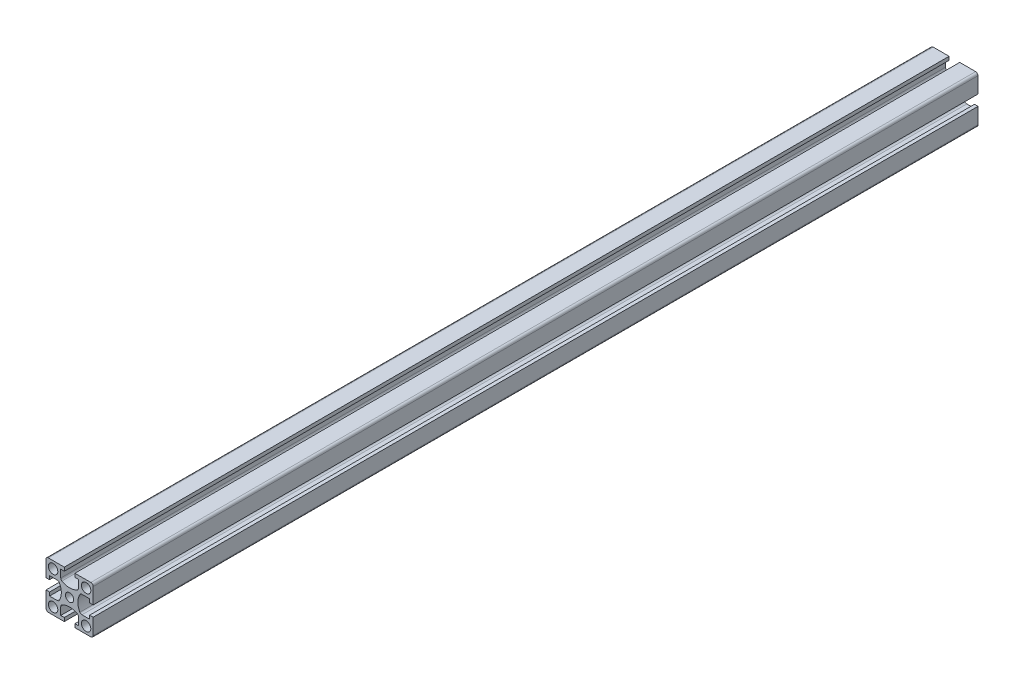
from build123d import *

# Parameters (mm, degrees)
SKETCH1_R           = 2
SKETCH1_R_2         = 1.75
BOSS_EXTRUDE1_DEPTH = 375


with BuildPart() as part:
    # Sketch1 → Boss-Extrude1 (new body)
    with BuildSketch(Plane.XY):
        with BuildLine():
            Line((-10, 9), (-10, 2.25))
            Line((-10, 2.25), (-8.5, 2.25))
            Line((-8.5, 2.25), (-8.5, 3.75))
            Line((-8.5, 3.75), (-5.236860279, 3.75))
            ThreePointArc((-5.236860279, 3.75), (-4.736860279, 3.616025404), (-4.370834875, 3.25))
            ThreePointArc((-4.370834875, 3.25), (-3.5, 0), (-4.370834875, -3.25))
            ThreePointArc((-4.370834875, -3.25), (-4.736860279, -3.616025404), (-5.236860279, -3.75))
            Line((-5.236860279, -3.75), (-8.5, -3.75))
            Line((-8.5, -3.75), (-8.5, -2.25))
            Line((-8.5, -2.25), (-10, -2.25))
            Line((-10, -2.25), (-10, -9))
            ThreePointArc((-10, -9), (-9.707106781, -9.707106781), (-9, -10))
            Line((-9, -10), (-2.25, -10))
            Line((-2.25, -10), (-2.25, -8.5))
            Line((-2.25, -8.5), (-3.75, -8.5))
            Line((-3.75, -8.5), (-3.75, -5.236860279))
            ThreePointArc((-3.75, -5.236860279), (-3.616025404, -4.736860279), (-3.25, -4.370834875))
            ThreePointArc((-3.25, -4.370834875), (0, -3.5), (3.25, -4.370834875))
            ThreePointArc((3.25, -4.370834875), (3.616025404, -4.736860279), (3.75, -5.236860279))
            Line((3.75, -5.236860279), (3.75, -8.5))
            Line((3.75, -8.5), (2.25, -8.5))
            Line((2.25, -8.5), (2.25, -10))
            Line((2.25, -10), (9, -10))
            ThreePointArc((9, -10), (9.707106781, -9.707106781), (10, -9))
            Line((10, -9), (10, -2.25))
            Line((10, -2.25), (8.5, -2.25))
            Line((8.5, -2.25), (8.5, -3.75))
            Line((8.5, -3.75), (5.236860279, -3.75))
            ThreePointArc((5.236860279, -3.75), (4.736860279, -3.616025404), (4.370834875, -3.25))
            ThreePointArc((4.370834875, -3.25), (3.5, 0), (4.370834875, 3.25))
            ThreePointArc((4.370834875, 3.25), (4.736860279, 3.616025404), (5.236860279, 3.75))
            Line((5.236860279, 3.75), (8.5, 3.75))
            Line((8.5, 3.75), (8.5, 2.25))
            Line((8.5, 2.25), (10, 2.25))
            Line((10, 2.25), (10, 9))
            ThreePointArc((10, 9), (9.707106781, 9.707106781), (9, 10))
            Line((9, 10), (2.25, 10))
            Line((2.25, 10), (2.25, 8.5))
            Line((2.25, 8.5), (3.75, 8.5))
            Line((3.75, 8.5), (3.75, 5.236860279))
            ThreePointArc((3.75, 5.236860279), (3.616025404, 4.736860279), (3.25, 4.370834875))
            ThreePointArc((3.25, 4.370834875), (0, 3.5), (-3.25, 4.370834875))
            ThreePointArc((-3.25, 4.370834875), (-3.616025404, 4.736860279), (-3.75, 5.236860279))
            Line((-3.75, 5.236860279), (-3.75, 8.5))
            Line((-3.75, 8.5), (-2.25, 8.5))
            Line((-2.25, 8.5), (-2.25, 10))
            Line((-2.25, 10), (-9, 10))
            ThreePointArc((-9, 10), (-9.707106781, 9.707106781), (-10, 9))
        make_face()
        with Locations((-7, -7)):
            Circle(SKETCH1_R, mode=Mode.SUBTRACT)
        with Locations((7, -7)):
            Circle(SKETCH1_R, mode=Mode.SUBTRACT)
        with Locations((7, 7)):
            Circle(SKETCH1_R, mode=Mode.SUBTRACT)
        Circle(SKETCH1_R_2, mode=Mode.SUBTRACT)
        with Locations((-7, 7)):
            Circle(SKETCH1_R, mode=Mode.SUBTRACT)
    extrude(amount=BOSS_EXTRUDE1_DEPTH)


solid = part.part
